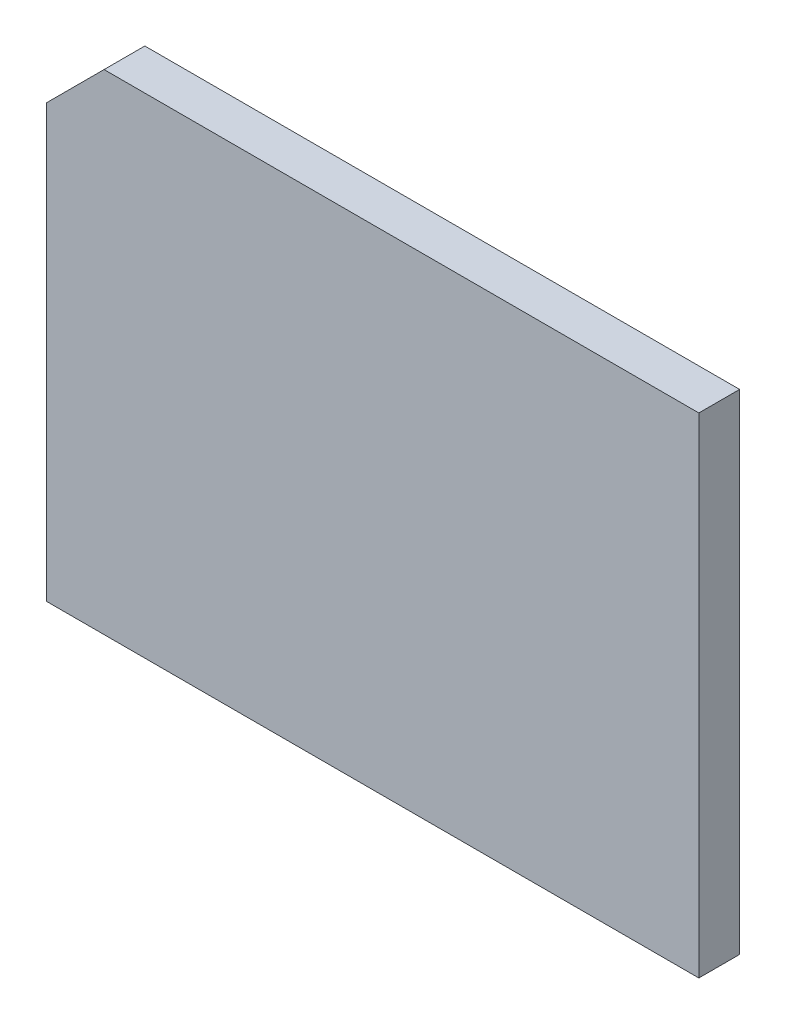
from build123d import *

# Parameters (mm, degrees)
BOSS_EXTRUDE1_DEPTH = 1.905


with BuildPart() as part:
    # Sketch1 → Boss-Extrude1 (new body)
    with BuildSketch(Plane.XY):
        Polygon((-15.24, 8.735923164), (-12.545923164, 11.43), (15.24, 11.43), (15.24, -11.43), (-15.24, -11.43), align=None)
    extrude(amount=BOSS_EXTRUDE1_DEPTH)


solid = part.part
